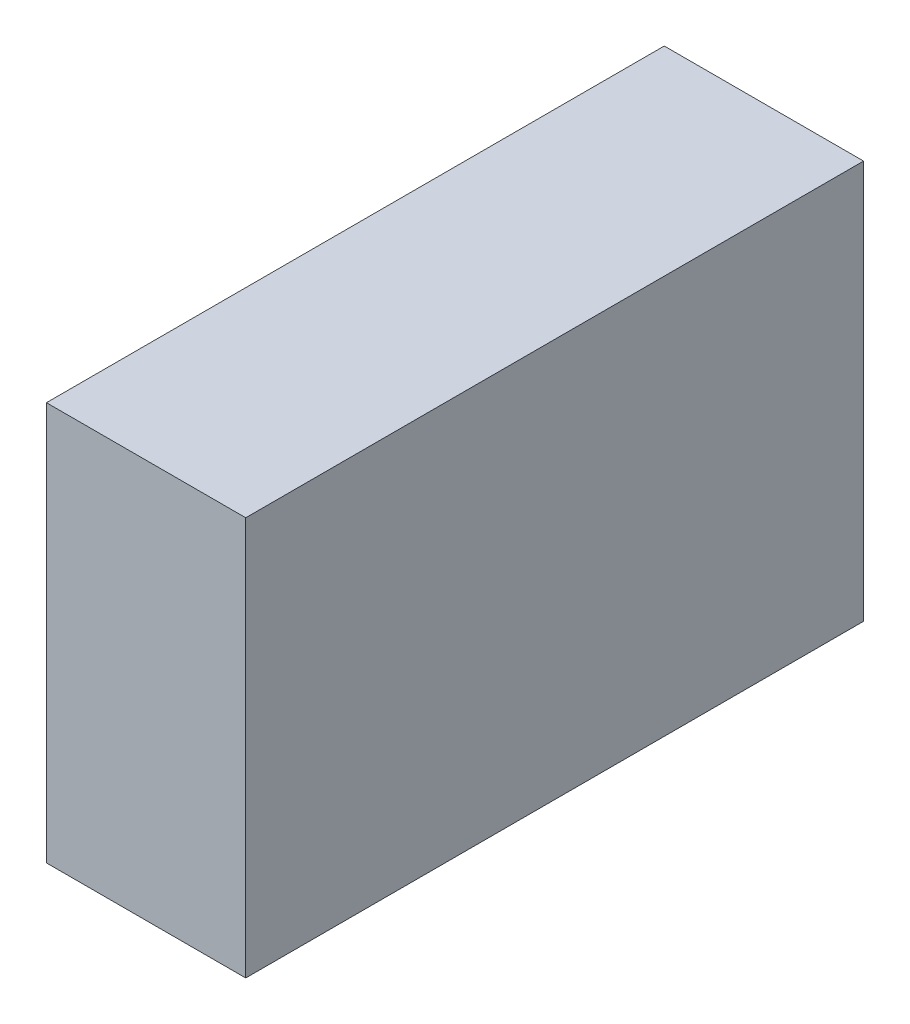
from build123d import *

# Parameters (mm, degrees)
SKETCH1_W           = 31
SKETCH1_H           = 20
BOSS_EXTRUDE1_DEPTH = 10


with BuildPart() as part:
    # Sketch1 → Boss-Extrude1 (new body)
    with BuildSketch(Plane(origin=(0, 0, 0), x_dir=(0, 0, -1), z_dir=(1, 0, 0))):
        with Locations((15.5, 10)):
            Rectangle(SKETCH1_W, SKETCH1_H)
    extrude(amount=-BOSS_EXTRUDE1_DEPTH)


solid = part.part
